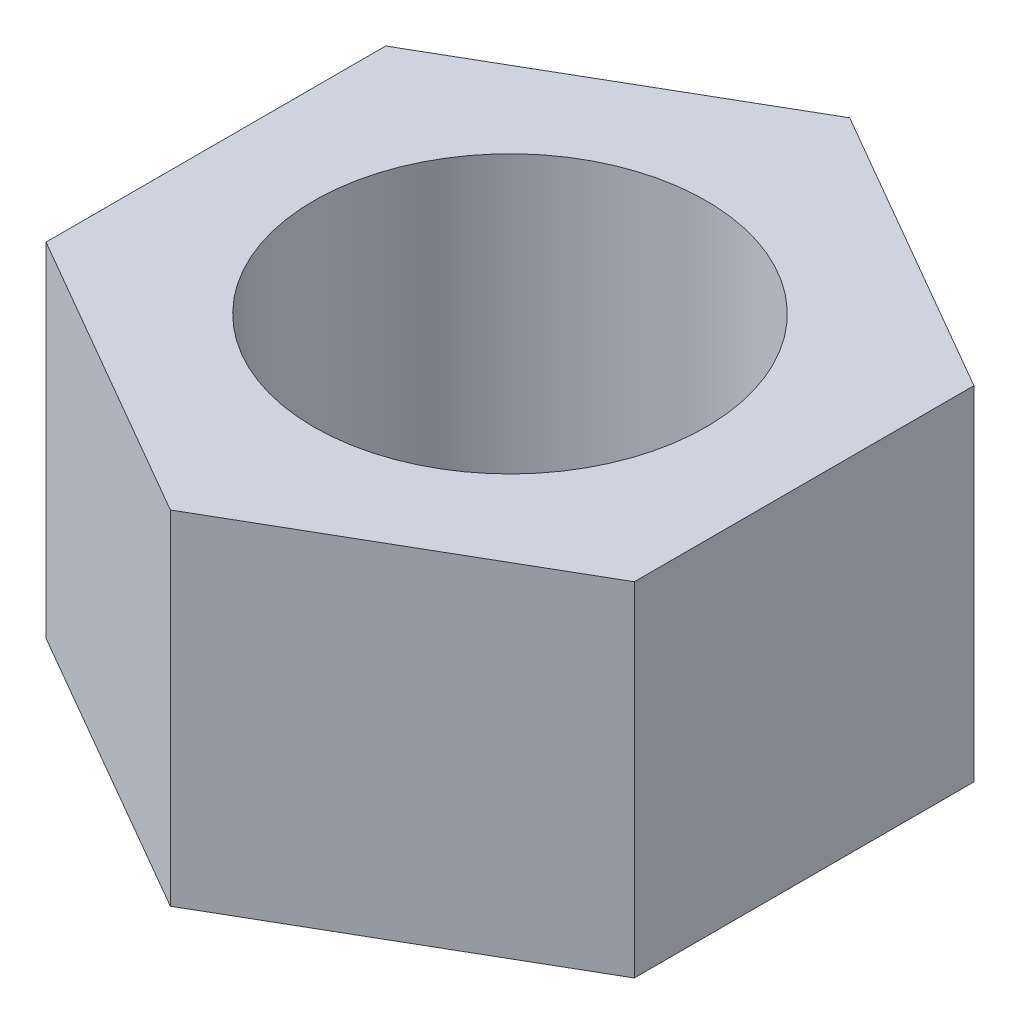
from build123d import *

# Parameters (mm, degrees)
BOSS_EXTRUDE1_DEPTH      = 4.167188
BOSS_EXTRUDE1_DEPTH_BACK = 4.167187
SKETCH11_R               = 4.7625


with BuildPart() as part:
    # Sketch11 → Boss-Extrude1 (new, two sides: drawn at the far end of the back side and taken through both)
    with BuildSketch(Plane(origin=(0, 0, 0), x_dir=(1, 0, 0), z_dir=(0, 1, 0)).offset(-BOSS_EXTRUDE1_DEPTH_BACK)):
        Polygon((0, 8.248891971), (-7.14375, 4.124445986), (-7.14375, -4.124445986), (0, -8.248891971), (7.14375, -4.124445986), (7.14375, 4.124445986), align=None)
        with Locations(Location((0, 0, 0), (0, 0, 270))):
            Circle(SKETCH11_R, mode=Mode.SUBTRACT)
    extrude(amount=BOSS_EXTRUDE1_DEPTH + BOSS_EXTRUDE1_DEPTH_BACK)


solid = part.part
